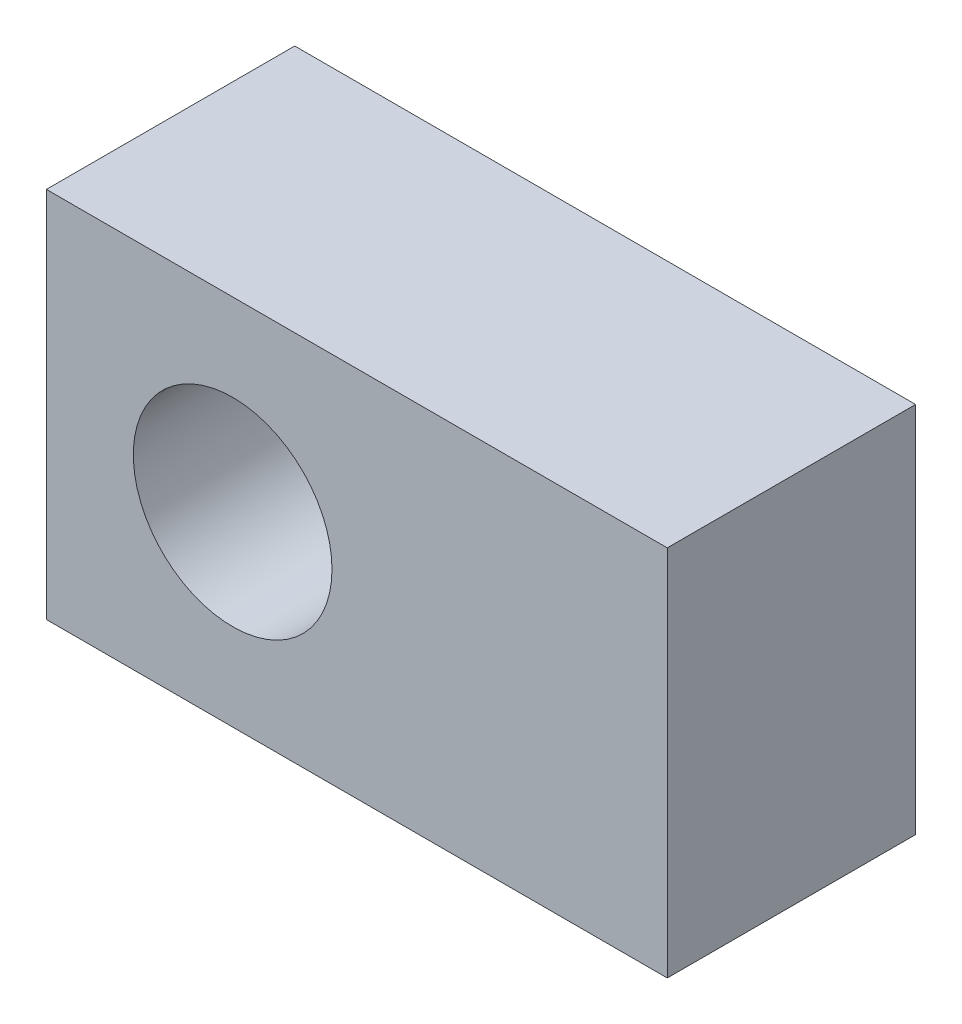
from build123d import *

# Parameters (mm, degrees)
SKETCH2_W           = 25
SKETCH2_H           = 15
SKETCH2_R           = 4
BOSS_EXTRUDE1_DEPTH = 10


with BuildPart() as part:
    # Sketch2 → Boss-Extrude1 (new body)
    with BuildSketch(Plane.XY):
        with Locations((12.5, 7.5)):
            Rectangle(SKETCH2_W, SKETCH2_H)
        with Locations((7.5, 7.5)):
            Circle(SKETCH2_R, mode=Mode.SUBTRACT)
    extrude(amount=BOSS_EXTRUDE1_DEPTH)


solid = part.part
